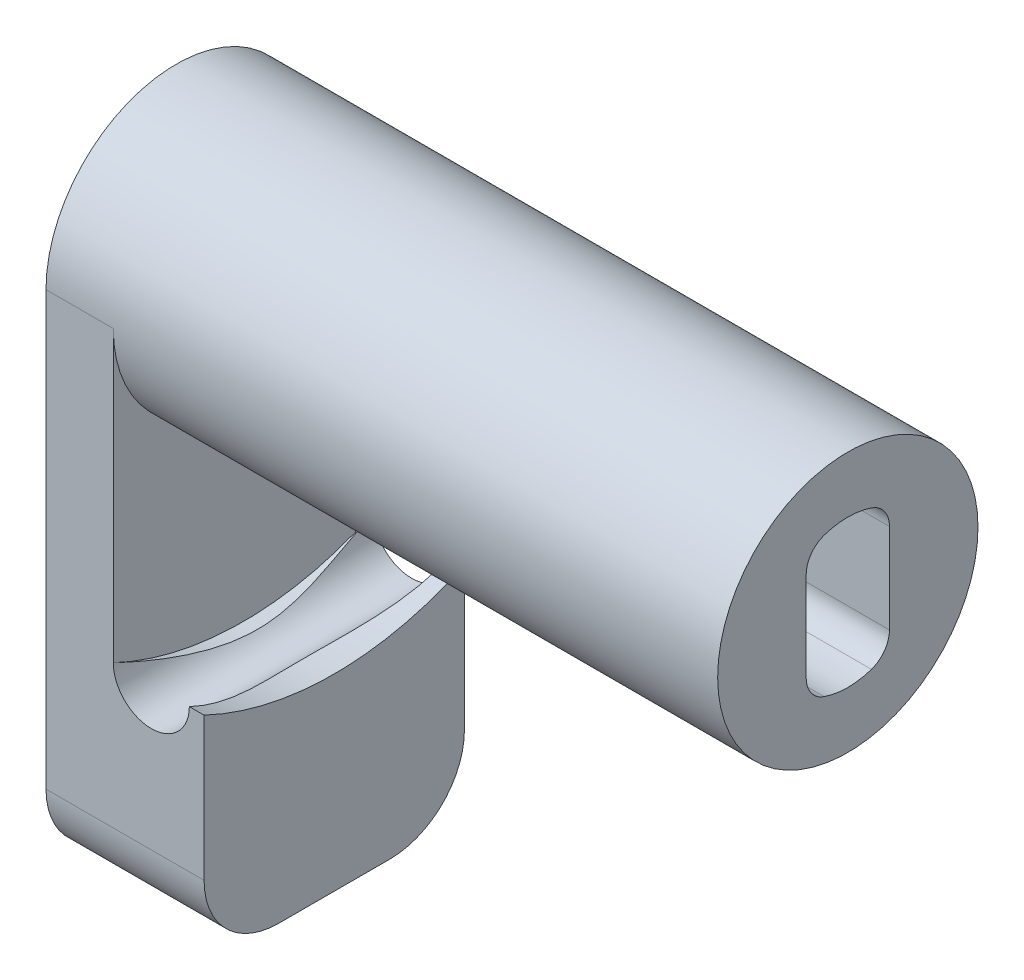
from build123d import *

# Parameters (mm, degrees)
SKETCH1_R           = 8.7376
BOSS_EXTRUDE1_DEPTH = 45.085
BOSS_EXTRUDE3_DEPTH = 4.516000112
FILLET2_R           = 5
BOSS_EXTRUDE4_START = 6.096
BOSS_EXTRUDE4_DEPTH = 6.096
CUT_EXTRUDE8_DEPTH  = 6.096
CUT_EXTRUDE10_DEPTH = 12.192
FILLET11_R          = 1.778
SKETCH25_R          = 2.5527
CUT_EXTRUDE14_DEPTH = 60.13111817
CUT_EXTRUDE15_DEPTH = 21.59
FILLET12_R          = 0.396875


with BuildPart() as part:
    # Sketch1 → Boss-Extrude1 (new body)
    with BuildSketch(Plane.YZ):
        with Locations(Location((0, 0, 0), (0, 0, 270))):
            Circle(SKETCH1_R)
    extrude(amount=BOSS_EXTRUDE1_DEPTH)

    # Sketch10 → Boss-Extrude3 (add)
    with BuildSketch(Plane(origin=(0, 0, 0), x_dir=(0, -1, 0), z_dir=(-1, 0, 0))):
        with BuildLine():
            Line((0, 8.7376), (34.036, 8.7376))
            Line((34.036, 8.7376), (34.036, -8.7376))
            Line((34.036, -8.7376), (0, -8.7376))
            ThreePointArc((0, -8.7376), (8.7376, 0), (0, 8.7376))
        make_face()
    extrude(amount=-BOSS_EXTRUDE3_DEPTH)

    # Fillet2
    fillet2_edges = [part.edges().sort_by_distance(p)[0] for p in [
        (2.258000056, -34.036, 8.7376),
        (2.258000056, -34.036, -8.7376),
    ]]
    fillet(fillet2_edges, radius=FILLET2_R)

    # Sketch15 → Boss-Extrude4 (add)
    with BuildSketch(Plane.YZ.offset(4.516000112).offset(BOSS_EXTRUDE4_START)):
        with BuildLine():
            Line((-18.796, 8.7376), (-29.036, 8.7376))
            ThreePointArc((-29.036, 8.7376), (-32.571533906, 7.273133906), (-34.036, 3.7376))
            Line((-34.036, 3.7376), (-34.036, -3.7376))
            ThreePointArc((-34.036, -3.7376), (-32.571533906, -7.273133906), (-29.036, -8.7376))
            Line((-29.036, -8.7376), (-18.796, -8.7376))
            Line((-18.796, -8.7376), (-18.796, 8.7376))
        make_face()
    extrude(amount=-BOSS_EXTRUDE4_DEPTH)

    # Sketch21 → Cut-Extrude8 (cut)
    with BuildSketch(Plane.YZ.offset(10.612000112)):
        with BuildLine():
            Line((-19.431, -8.7376), (-18.796, -8.7376))
            Line((-18.796, -8.7376), (-18.796, 8.7376))
            Line((-18.796, 8.7376), (-19.431, 8.7376))
            ThreePointArc((-19.431, 8.7376), (-21.405517007, 0), (-19.431, -8.7376))
        make_face()
    extrude(amount=-CUT_EXTRUDE8_DEPTH, mode=Mode.SUBTRACT)

    # Sketch22 → Cut-Extrude10 (cut)
    with BuildSketch(Plane.YZ.offset(45.085)):
        with BuildLine():
            Line((-4.089715516, -2.794), (4.089715516, -2.794))
            ThreePointArc((4.089715516, -2.794), (4.953, 0), (4.089715516, 2.794))
            Line((4.089715516, 2.794), (-4.089715516, 2.794))
            ThreePointArc((-4.089715516, 2.794), (-4.953, 0), (-4.089715516, -2.794))
        make_face()
    extrude(amount=-CUT_EXTRUDE10_DEPTH, mode=Mode.SUBTRACT)

    # Fillet11
    fillet11_edges = [part.edges().sort_by_distance(p)[0] for p in [
        (38.989, 4.089715516, 2.794),
        (38.989, 4.089715516, -2.794),
        (38.989, -4.089715516, -2.794),
        (38.989, -4.089715516, 2.794),
    ]]
    fillet(fillet11_edges, radius=FILLET11_R)

    # Sketch25 → Cut-Extrude14 (cut, through all)
    with BuildSketch(Plane(origin=(0, 0, -8.7376), x_dir=(1, 0, 0), z_dir=(0, 0, -1))):
        with Locations((7.068700112, 19.431)):
            Circle(SKETCH25_R)
    extrude(amount=-CUT_EXTRUDE14_DEPTH, mode=Mode.SUBTRACT)

    # Sketch26 → Cut-Extrude15 (cut)
    with BuildSketch(Plane(origin=(0, 0, 0), x_dir=(0, -1, 0), z_dir=(-1, 0, 0))):
        with BuildLine():
            Line((3.741114774, 1.5875), (5.392114774, 1.5875))
            Line((5.392114774, 1.5875), (5.392114774, -1.5875))
            Line((5.392114774, -1.5875), (3.741114774, -1.5875))
            ThreePointArc((3.741114774, -1.5875), (-4.064, 0), (3.741114774, 1.5875))
        make_face()
    extrude(amount=-CUT_EXTRUDE15_DEPTH, mode=Mode.SUBTRACT)

    # Fillet12
    fillet12_edges = [part.edges().sort_by_distance(p)[0] for p in [
        (10.795, -3.741114774, -1.5875),
        (10.795, -3.741114774, 1.5875),
        (10.795, -5.392114774, 1.5875),
        (10.795, -5.392114774, -1.5875),
    ]]
    fillet(fillet12_edges, radius=FILLET12_R)


solid = part.part
